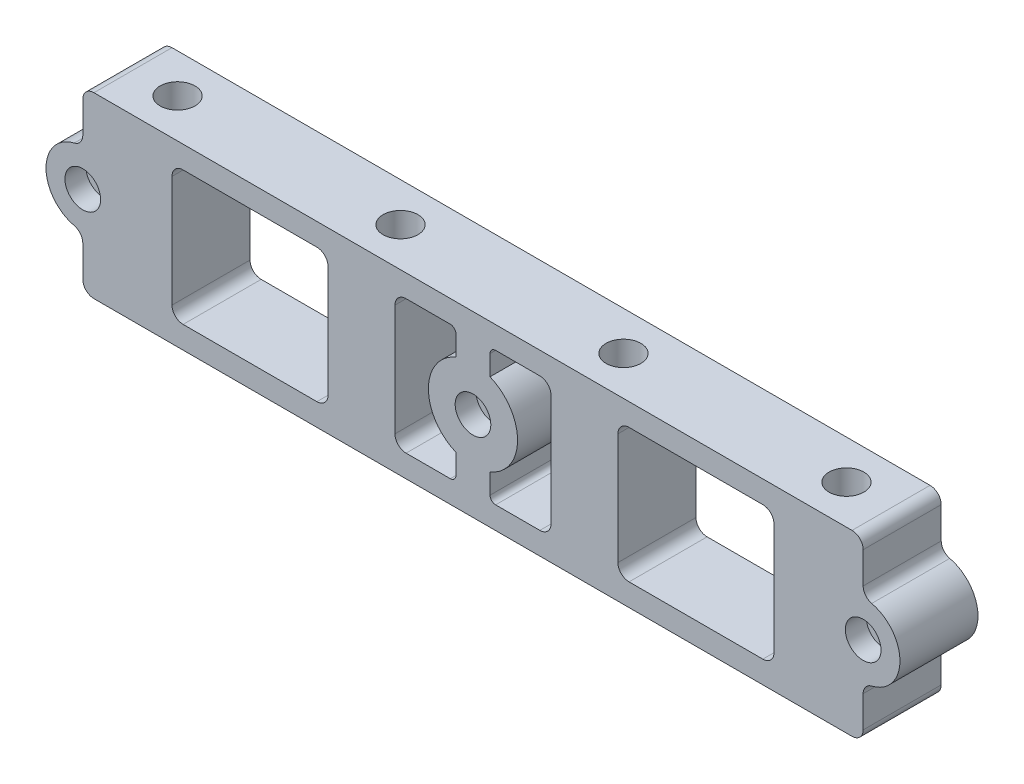
from build123d import *

# Parameters (mm, degrees)
SKETCH1_W           = 195.2625
SKETCH1_H           = 40.64
SKETCH1_R           = 2.4892
BOSS_EXTRUDE1_DEPTH = 17.78
SKETCH2_R           = 3.96875
CUT_EXTRUDE1_DEPTH  = 40.64
SKETCH3_R           = 4.064
CUT_EXTRUDE2_DEPTH  = 4.7752
CUT_EXTRUDE3_DEPTH  = 17.78
FILLET1_R           = 2.54


with BuildPart() as part:
    # Sketch1 → Boss-Extrude1 (new body)
    with BuildSketch(Plane.XY):
        with Locations((-88.9, 0)):
            Rectangle(SKETCH1_W, SKETCH1_H)
        Circle(SKETCH1_R, mode=Mode.SUBTRACT)
        with Locations((-177.8, 0)):
            Circle(SKETCH1_R, mode=Mode.SUBTRACT)
        with Locations((-88.9, 0)):
            Circle(SKETCH1_R, mode=Mode.SUBTRACT)
    extrude(amount=-BOSS_EXTRUDE1_DEPTH)

    # Sketch2 → Cut-Extrude1 (cut)
    with BuildSketch(Plane(origin=(0, 20.32, 0), x_dir=(1, 0, 0), z_dir=(0, 1, 0))):
        with Locations(Location((-12.7, 8.89, 0), (0, 0, 270))):
            Circle(SKETCH2_R)
        with Locations(Location((-63.5, 8.89, 0), (0, 0, 270))):
            Circle(SKETCH2_R)
        with Locations(Location((-114.3, 8.89, 0), (0, 0, 270))):
            Circle(SKETCH2_R)
        with Locations(Location((-165.1, 8.89, 0), (0, 0, 270))):
            Circle(SKETCH2_R)
    extrude(amount=-CUT_EXTRUDE1_DEPTH, mode=Mode.SUBTRACT)

    # Sketch3 → Cut-Extrude2 (cut)
    with BuildSketch(Plane.XY):
        Circle(SKETCH3_R)
        with Locations((-88.9, 0)):
            Circle(SKETCH3_R)
        with Locations((-177.8, 0)):
            Circle(SKETCH3_R)
    extrude(amount=-CUT_EXTRUDE2_DEPTH, mode=Mode.SUBTRACT)

    # Sketch5 → Cut-Extrude3 (cut)
    with BuildSketch(Plane.XY):
        with BuildLine():
            Line((0, -20.32), (8.73125, -20.32))
            Line((8.73125, -20.32), (8.73125, 20.32))
            Line((8.73125, 20.32), (0, 20.32))
            Line((0, 20.32), (0, 10.622546022))
            ThreePointArc((0, 10.622546022), (0.546012526, 9.049137635), (1.949302326, 8.152186482))
            ThreePointArc((1.949302326, 8.152186482), (8.382, 0), (1.949302326, -8.152186482))
            ThreePointArc((1.949302326, -8.152186482), (0.546012526, -9.049137635), (0, -10.622546022))
            Line((0, -10.622546022), (0, -20.32))
        make_face()
        with BuildLine():
            Line((-22.86, -15.24), (-53.34, -15.24))
            ThreePointArc((-53.34, -15.24), (-55.136051224, -14.496051224), (-55.88, -12.7))
            Line((-55.88, -12.7), (-55.88, 12.7))
            ThreePointArc((-55.88, 12.7), (-55.136051224, 14.496051224), (-53.34, 15.24))
            Line((-53.34, 15.24), (-22.86, 15.24))
            ThreePointArc((-22.86, 15.24), (-21.063948776, 14.496051224), (-20.32, 12.7))
            Line((-20.32, 12.7), (-20.32, -12.7))
            ThreePointArc((-20.32, -12.7), (-21.063948776, -14.496051224), (-22.86, -15.24))
        make_face()
        with BuildLine():
            Line((-85.011936327, -9.38661605), (-85.011936327, -13.97))
            ThreePointArc((-85.011936327, -13.97), (-84.639961939, -14.868025612), (-83.741936327, -15.24))
            Line((-83.741936327, -15.24), (-73.66, -15.24))
            ThreePointArc((-73.66, -15.24), (-71.863948776, -14.496051224), (-71.12, -12.7))
            Line((-71.12, -12.7), (-71.12, 12.7))
            ThreePointArc((-71.12, 12.7), (-71.863948776, 14.496051224), (-73.66, 15.24))
            Line((-73.66, 15.24), (-83.741936327, 15.24))
            ThreePointArc((-83.741936327, 15.24), (-84.639961939, 14.868025612), (-85.011936327, 13.97))
            Line((-85.011936327, 13.97), (-85.011936327, 9.38661605))
            ThreePointArc((-85.011936327, 9.38661605), (-78.74, 0), (-85.011936327, -9.38661605))
        make_face()
        with BuildLine():
            Line((-104.14, 15.24), (-94.058063673, 15.24))
            ThreePointArc((-94.058063673, 15.24), (-93.160038061, 14.868025612), (-92.788063673, 13.97))
            Line((-92.788063673, 13.97), (-92.788063673, 9.38661605))
            ThreePointArc((-92.788063673, 9.38661605), (-99.06, 0), (-92.788063673, -9.38661605))
            Line((-92.788063673, -9.38661605), (-92.788063673, -13.97))
            ThreePointArc((-92.788063673, -13.97), (-93.160038061, -14.868025612), (-94.058063673, -15.24))
            Line((-94.058063673, -15.24), (-104.14, -15.24))
            ThreePointArc((-104.14, -15.24), (-105.936051224, -14.496051224), (-106.68, -12.7))
            Line((-106.68, -12.7), (-106.68, 12.7))
            ThreePointArc((-106.68, 12.7), (-105.936051224, 14.496051224), (-104.14, 15.24))
        make_face()
        with BuildLine():
            Line((-154.94, 15.24), (-124.46, 15.24))
            ThreePointArc((-124.46, 15.24), (-122.663948776, 14.496051224), (-121.92, 12.7))
            Line((-121.92, 12.7), (-121.92, -12.7))
            ThreePointArc((-121.92, -12.7), (-122.663948776, -14.496051224), (-124.46, -15.24))
            Line((-124.46, -15.24), (-154.94, -15.24))
            ThreePointArc((-154.94, -15.24), (-156.736051224, -14.496051224), (-157.48, -12.7))
            Line((-157.48, -12.7), (-157.48, 12.7))
            ThreePointArc((-157.48, 12.7), (-156.736051224, 14.496051224), (-154.94, 15.24))
        make_face()
        with BuildLine():
            Line((-186.53125, -20.32), (-186.53125, 20.32))
            Line((-186.53125, 20.32), (-177.8, 20.32))
            Line((-177.8, 20.32), (-177.8, 10.622546022))
            ThreePointArc((-177.8, 10.622546022), (-178.346012526, 9.049137635), (-179.749302326, 8.152186482))
            ThreePointArc((-179.749302326, 8.152186482), (-186.182, 0), (-179.749302326, -8.152186482))
            ThreePointArc((-179.749302326, -8.152186482), (-178.346012526, -9.049137635), (-177.8, -10.622546022))
            Line((-177.8, -10.622546022), (-177.8, -20.32))
            Line((-177.8, -20.32), (-186.53125, -20.32))
        make_face()
    extrude(amount=-CUT_EXTRUDE3_DEPTH, mode=Mode.SUBTRACT)

    # Fillet1
    fillet1_edges = [part.edges().sort_by_distance(p)[0] for p in [
        (0, 20.32, -8.89),
        (0, -20.32, -8.89),
        (-177.8, -20.32, -8.89),
        (-177.8, 20.32, -8.89),
    ]]
    fillet(fillet1_edges, radius=FILLET1_R)


solid = part.part
